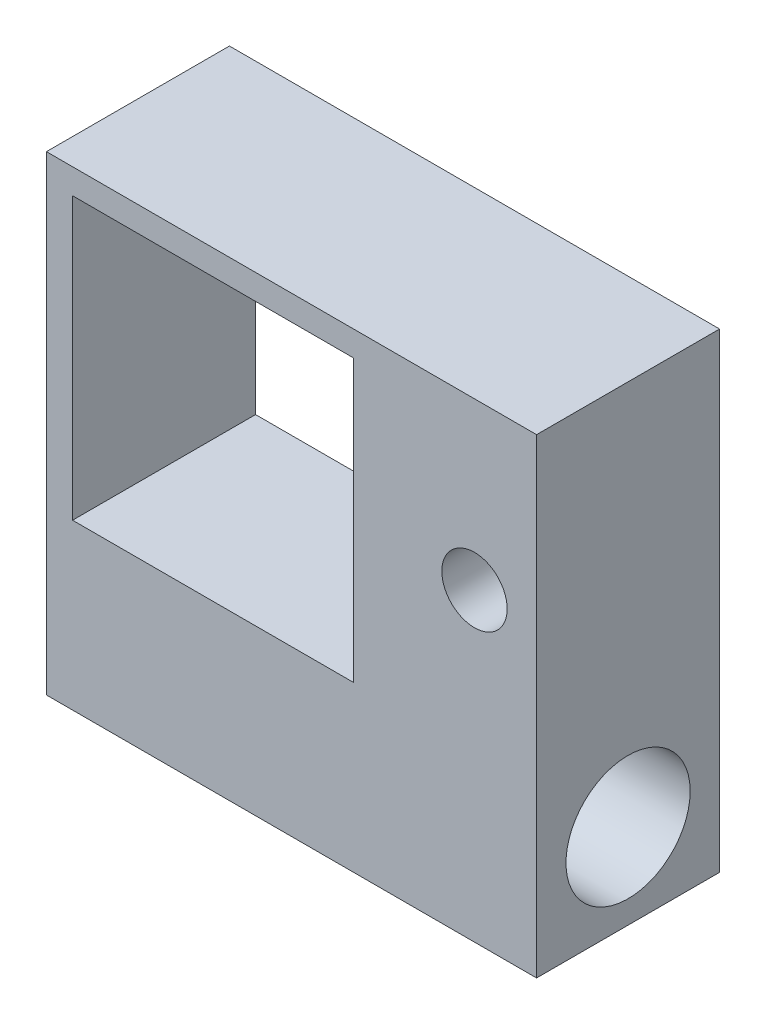
from build123d import *

# Parameters (mm, degrees)
SKETCH1_W           = 75
SKETCH1_H           = 72
SKETCH1_R           = 5
SKETCH1_W_2         = 43
SKETCH1_H_2         = 43
BOSS_EXTRUDE1_DEPTH = 28
SKETCH2_R           = 9.5
CUT_EXTRUDE1_DEPTH  = 88.778129395


with BuildPart() as part:
    # Sketch1 → Boss-Extrude1 (new body)
    with BuildSketch(Plane.XY):
        Rectangle(SKETCH1_W, SKETCH1_H)
        with Locations((28, 10.66)):
            Circle(SKETCH1_R, mode=Mode.SUBTRACT)
        with Locations((-12, 10.66)):
            Rectangle(SKETCH1_W_2, SKETCH1_H_2, mode=Mode.SUBTRACT)
    extrude(amount=BOSS_EXTRUDE1_DEPTH)

    # Sketch2 → Cut-Extrude1 (cut, through all)
    with BuildSketch(Plane(origin=(37.5, 0, 0), x_dir=(0, 0, -1), z_dir=(1, 0, 0))):
        with Locations((-14, -23)):
            Circle(SKETCH2_R)
    extrude(amount=-CUT_EXTRUDE1_DEPTH, mode=Mode.SUBTRACT)


solid = part.part
